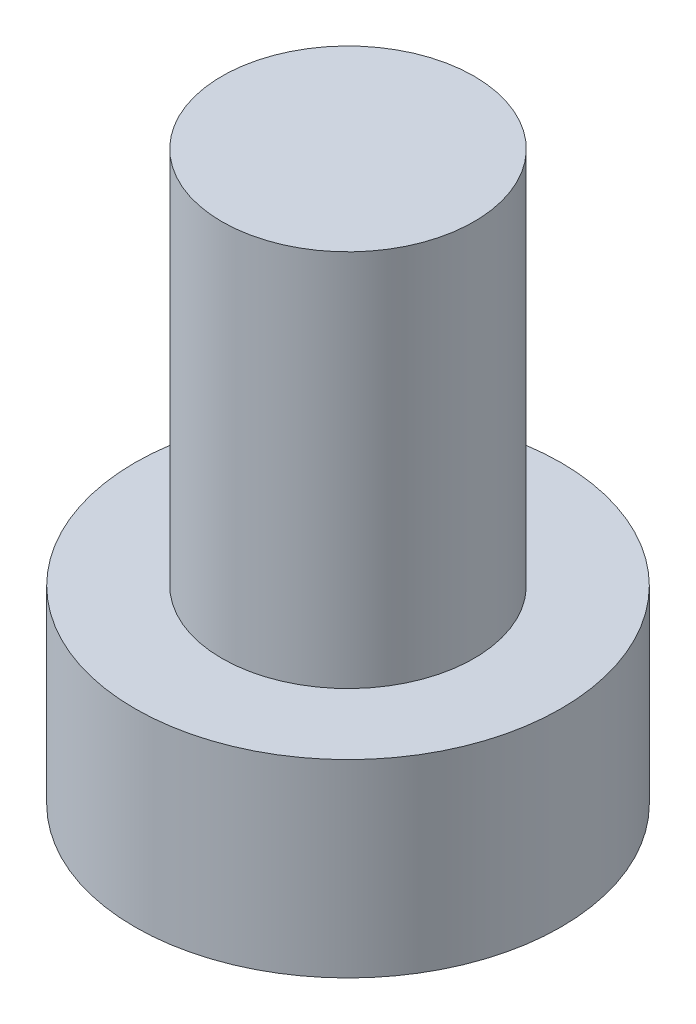
from build123d import *

# Parameters (mm, degrees)
SKETCH1_R           = 3.38
SKETCH1_R_2         = 2
BOSS_EXTRUDE1_DEPTH = 3
SKETCH1_2_R         = 2
BOSS_EXTRUDE2_DEPTH = 9


with BuildPart() as part:
    # Sketch1 → Boss-Extrude1 (new body)
    with BuildSketch(Plane(origin=(0, 0, 0), x_dir=(1, 0, 0), z_dir=(0, 1, 0))):
        Circle(SKETCH1_R)
        Circle(SKETCH1_R_2, mode=Mode.SUBTRACT)
    extrude(amount=BOSS_EXTRUDE1_DEPTH)

    # Sketch1<2> → Boss-Extrude2 (add)
    with BuildSketch(Plane(origin=(0, 0, 0), x_dir=(1, 0, 0), z_dir=(0, 1, 0))):
        Circle(SKETCH1_2_R)
    extrude(amount=BOSS_EXTRUDE2_DEPTH)


solid = part.part
